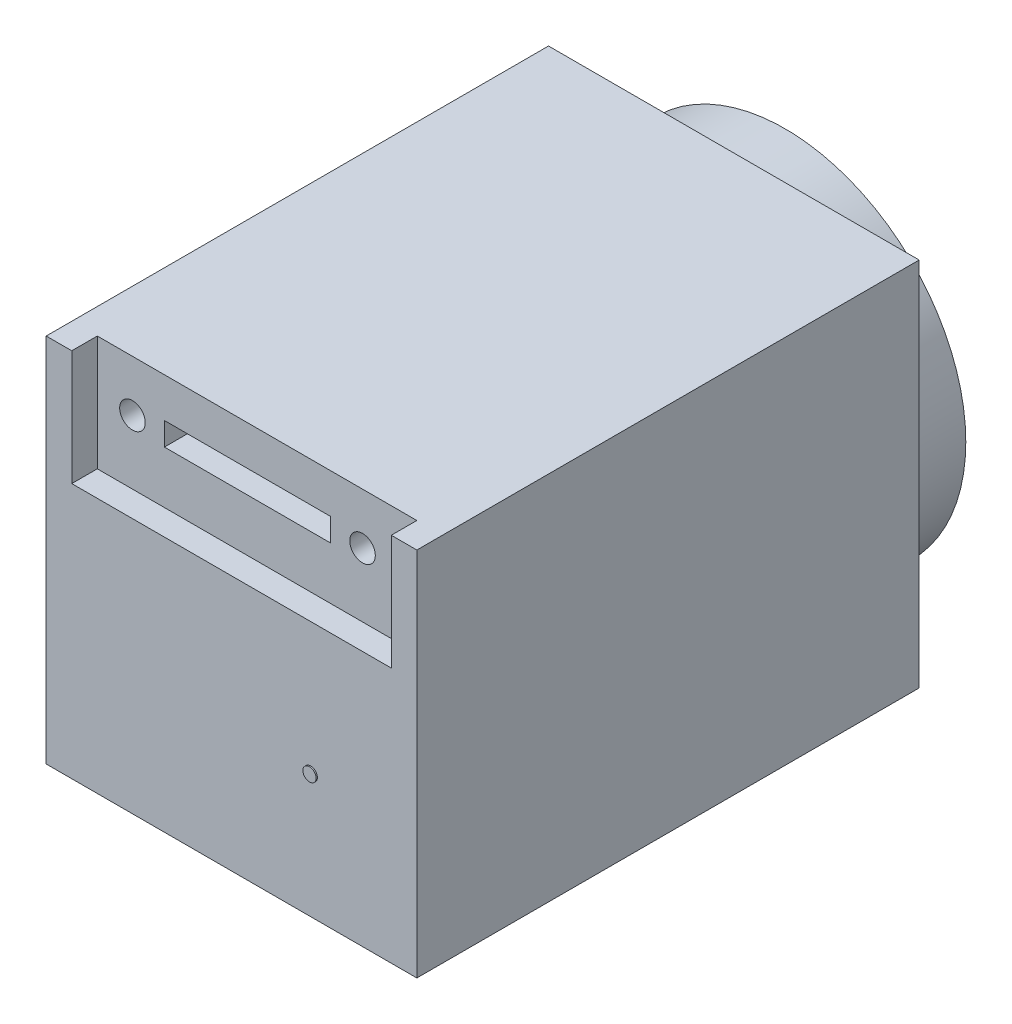
from build123d import *

# Parameters (mm, degrees)
SKETCH2_W           = 29
SKETCH2_H           = 29
BOSS_EXTRUDE1_DEPTH = 39.3
SKETCH3_R           = 14.15
SKETCH3_R_2         = 12.7
BOSS_EXTRUDE2_DEPTH = 4
SKETCH4_W           = 25
SKETCH4_H           = 9
CUT_EXTRUDE1_DEPTH  = 2
SKETCH5_R           = 1
SKETCH5_W           = 13
SKETCH5_H           = 1.8
CUT_EXTRUDE2_DEPTH  = 5
SKETCH6_R           = 0.517544676
BOSS_EXTRUDE3_DEPTH = 0.1
SKETCH7_R           = 3
CUT_EXTRUDE3_DEPTH  = 7


with BuildPart() as part:
    # Sketch2 → Boss-Extrude1 (new body)
    with BuildSketch(Plane.XY):
        with Locations((-23.624610592, 3.658878505)):
            Rectangle(SKETCH2_W, SKETCH2_H)
    extrude(amount=BOSS_EXTRUDE1_DEPTH)

    # Sketch3 → Boss-Extrude2 (add)
    with BuildSketch(Plane(origin=(0, 0, 0), x_dir=(-1, 0, 0), z_dir=(0, 0, -1))):
        with Locations(Location((23.624610592, 3.658878505, 0), (0, 0, 180))):
            Circle(SKETCH3_R)
        with Locations((23.624610592, 3.658878505)):
            Circle(SKETCH3_R_2, mode=Mode.SUBTRACT)
    extrude(amount=BOSS_EXTRUDE2_DEPTH)

    # Sketch4 → Cut-Extrude1 (cut)
    with BuildSketch(Plane.XY.offset(39.3)):
        with Locations((-23.624610592, 13.658878505)):
            Rectangle(SKETCH4_W, SKETCH4_H)
    extrude(amount=-CUT_EXTRUDE1_DEPTH, mode=Mode.SUBTRACT)

    # Sketch5 → Cut-Extrude2 (cut)
    with BuildSketch(Plane.XY.offset(37.3)):
        with Locations((-33.374610592, 14.158878505)):
            Circle(SKETCH5_R)
        with Locations((-15.374610592, 14.158878505)):
            Circle(SKETCH5_R)
        with Locations((-24.374610592, 14.158878505)):
            Rectangle(SKETCH5_W, SKETCH5_H)
    extrude(amount=-CUT_EXTRUDE2_DEPTH, mode=Mode.SUBTRACT)

    # Sketch6 → Boss-Extrude3 (add)
    with BuildSketch(Plane.XY.offset(39.3)):
        with Locations((-17.424610592, -1.141121495)):
            Circle(SKETCH6_R)
    extrude(amount=BOSS_EXTRUDE3_DEPTH)

    # Sketch7 → Cut-Extrude3 (cut)
    with BuildSketch(Plane.XZ.offset(10.841121495)):
        with Locations(Location((-23.417250102, 19.368990784, 0), (0, 0, 270))):
            Circle(SKETCH7_R)
    extrude(amount=-CUT_EXTRUDE3_DEPTH, mode=Mode.SUBTRACT)


solid = part.part
